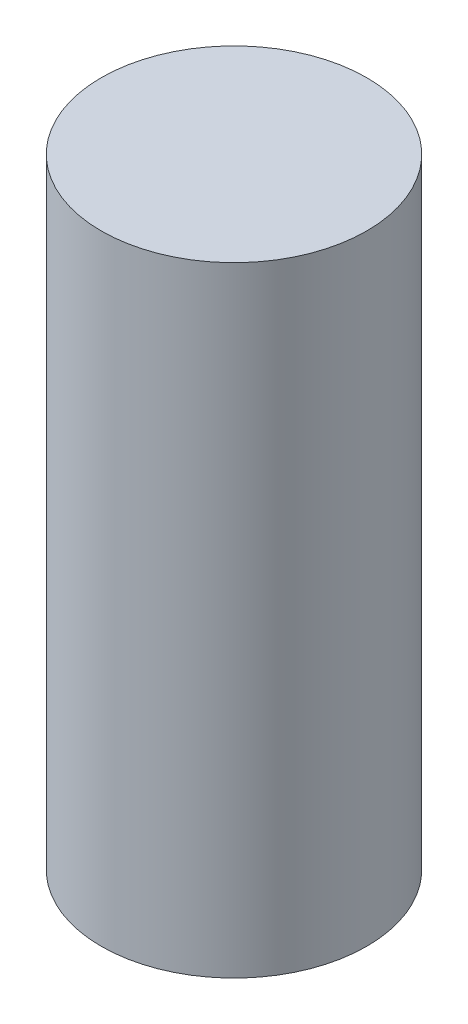
from build123d import *

# Parameters (mm, degrees)
SKETCH1_R           = 3
BOSS_EXTRUDE1_DEPTH = 14


with BuildPart() as part:
    # Sketch1 → Boss-Extrude1 (new body)
    with BuildSketch(Plane(origin=(0, 0, 0), x_dir=(1, 0, 0), z_dir=(0, 1, 0))):
        with Locations(Location((0, 0, 0), (0, 0, 270))):
            Circle(SKETCH1_R)
    extrude(amount=BOSS_EXTRUDE1_DEPTH)


solid = part.part
